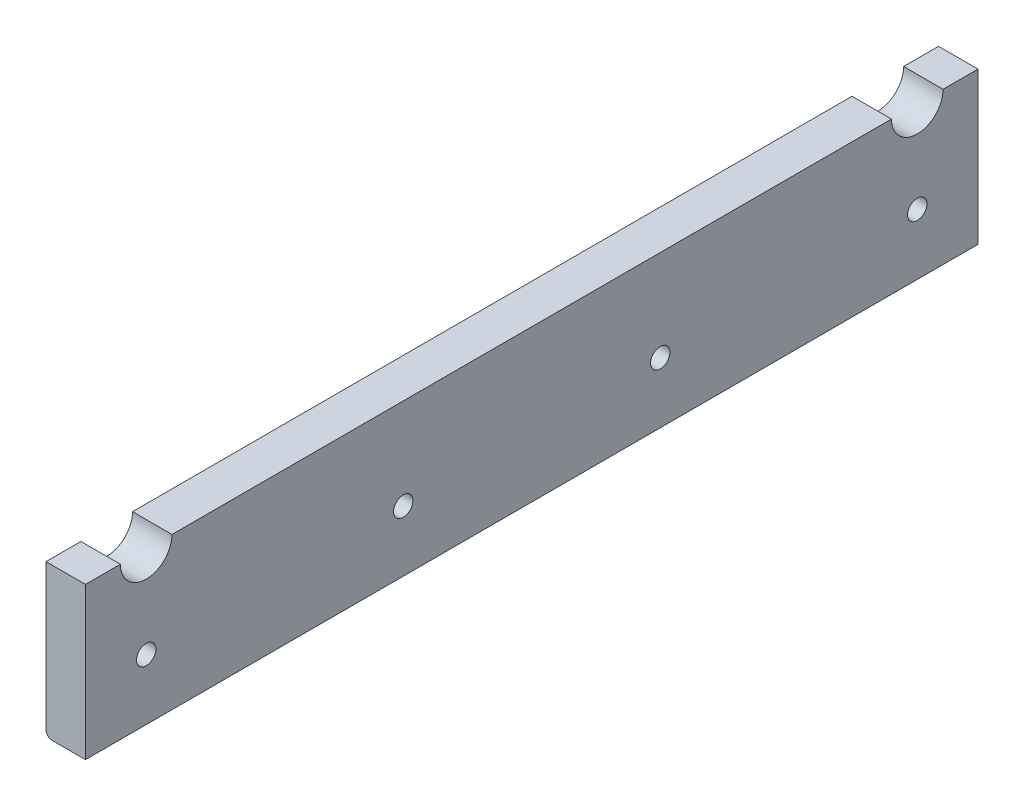
from build123d import *

# Parameters (mm, degrees)
SKETCH_2_W          = 6.5
SKETCH_2_H          = 25
EXTRUDE_1_DEPTH     = 73.5
FILLET_1_R          = 1
SKETCH_3_R          = 1.6
CUT_EXTRUDE_1_DEPTH = 75.838158716
CHAMFER_2_SIZE      = 2
SKETCH_4_R          = 4.25
CUT_EXTRUDE_2_DEPTH = 75.838158716


with BuildPart() as part:
    # 草图2 → 凸台-拉伸1 (new, symmetric)
    with BuildSketch(Plane.XY):
        Rectangle(SKETCH_2_W, SKETCH_2_H)
    extrude(amount=EXTRUDE_1_DEPTH, both=True)

    # 圆角1
    fillet_1_edges = [part.edges().sort_by_distance(p)[0] for p in [
        (-3.25, -12.5, 0),
    ]]
    fillet(fillet_1_edges, radius=FILLET_1_R)

    # 草图3 → 切除-拉伸1 (cut, through all)
    with BuildSketch(Plane.ZY.offset(3.25)):
        with Locations(Location((63.5, -2.5, 0), (0, 0, 270))):
            Circle(SKETCH_3_R)
        with Locations(Location((21.166666667, -2.5, 0), (0, 0, 270))):
            Circle(SKETCH_3_R)
        with Locations(Location((-21.166666667, -2.5, 0), (0, 0, 270))):
            Circle(SKETCH_3_R)
        with Locations(Location((-63.5, -2.5, 0), (0, 0, 270))):
            Circle(SKETCH_3_R)
    extrude(amount=-CUT_EXTRUDE_1_DEPTH, mode=Mode.SUBTRACT)

    # 倒角2
    chamfer_2_edges = [part.edges().sort_by_distance(p)[0] for p in [
        (-3.25, -0.9, 63.5),
        (-3.25, -0.9, 21.166666667),
        (-3.25, -0.9, -21.166666667),
        (-3.25, -0.9, -63.5),
    ]]
    chamfer(chamfer_2_edges, length=CHAMFER_2_SIZE)

    # 草图4 → 切除-拉伸2 (cut, through all)
    with BuildSketch(Plane.ZY.offset(3.25)):
        with Locations((-63.5, 12.5)):
            Circle(SKETCH_4_R)
        with Locations((63.5, 12.5)):
            Circle(SKETCH_4_R)
    extrude(amount=-CUT_EXTRUDE_2_DEPTH, mode=Mode.SUBTRACT)


solid = part.part
